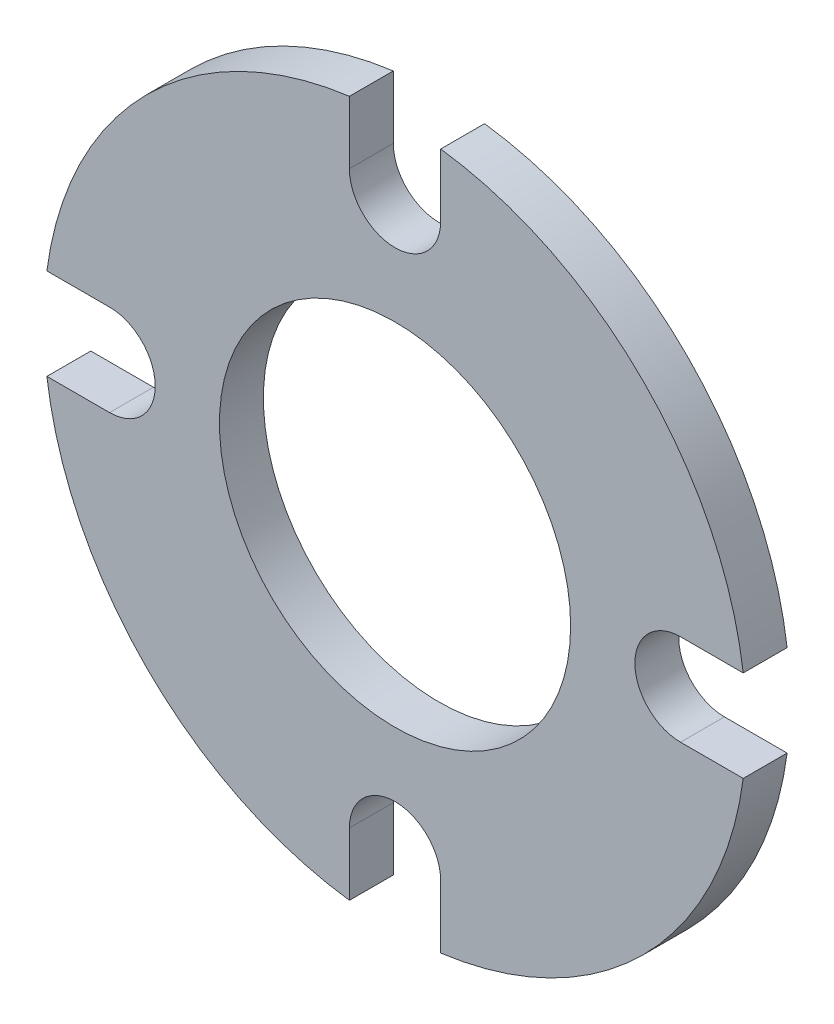
from build123d import *

# Parameters (mm, degrees)
SKETCH2_R           = 0.5
BOSS_EXTRUDE1_DEPTH = 0.0625


with BuildPart() as part:
    # Sketch2 → Boss-Extrude1 (new, symmetric)
    with BuildSketch(Plane.XY):
        with BuildLine():
            Line((-0.13, -0.991513994), (-0.13, -0.813))
            ThreePointArc((-0.13, -0.813), (0, -0.683), (0.13, -0.813))
            Line((0.13, -0.813), (0.13, -0.991513994))
            ThreePointArc((0.13, -0.991513994), (0.707106781, -0.707106781), (0.991513994, -0.13))
            Line((0.991513994, -0.13), (0.813, -0.13))
            ThreePointArc((0.813, -0.13), (0.683, 0), (0.813, 0.13))
            Line((0.813, 0.13), (0.991513994, 0.13))
            ThreePointArc((0.991513994, 0.13), (0.707106781, 0.707106781), (0.13, 0.991513994))
            Line((0.13, 0.991513994), (0.13, 0.813))
            ThreePointArc((0.13, 0.813), (0, 0.683), (-0.13, 0.813))
            Line((-0.13, 0.813), (-0.13, 0.991513994))
            ThreePointArc((-0.13, 0.991513994), (-0.707106781, 0.707106781), (-0.991513994, 0.13))
            Line((-0.991513994, 0.13), (-0.813, 0.13))
            ThreePointArc((-0.813, 0.13), (-0.683, 0), (-0.813, -0.13))
            Line((-0.813, -0.13), (-0.991513994, -0.13))
            ThreePointArc((-0.991513994, -0.13), (-0.707106781, -0.707106781), (-0.13, -0.991513994))
        make_face()
        Circle(SKETCH2_R, mode=Mode.SUBTRACT)
    extrude(amount=BOSS_EXTRUDE1_DEPTH, both=True)


solid = part.part
